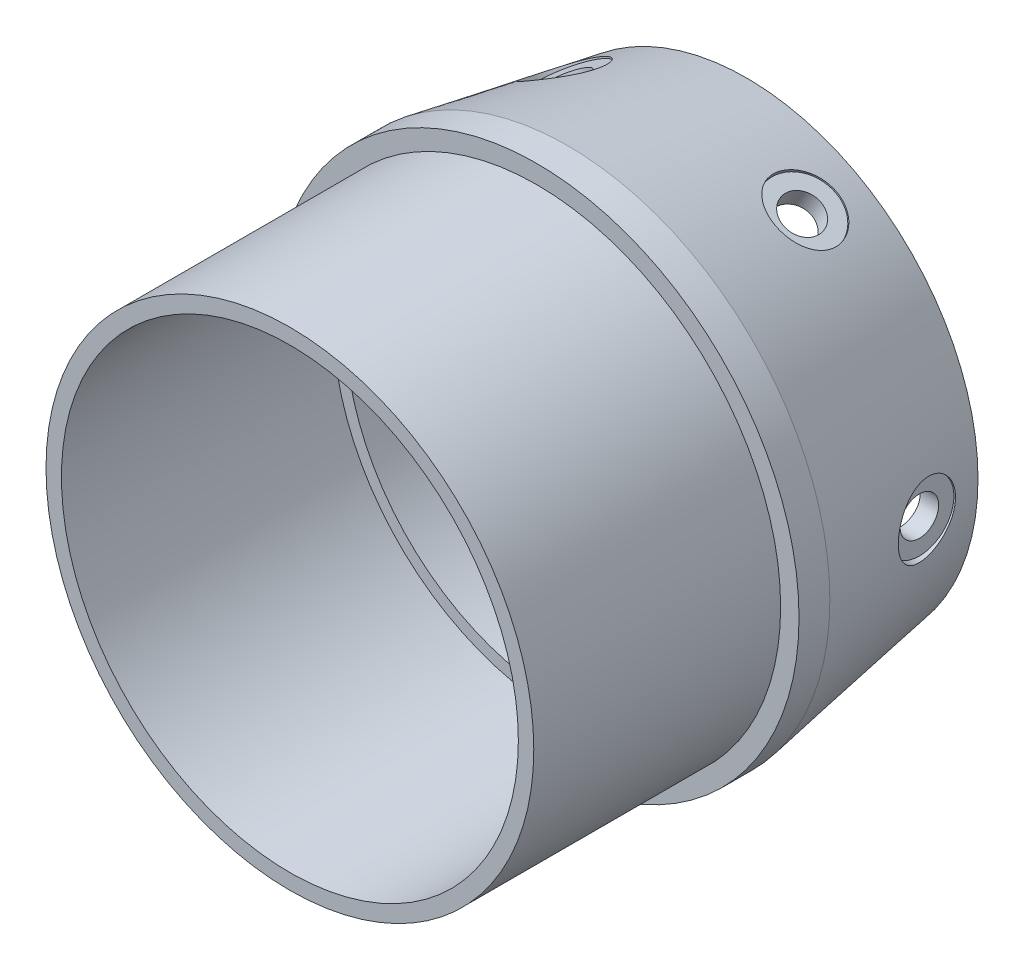
from build123d import *

# Parameters (mm, degrees)
SKETCH2_R          = 1.9812
CUT_EXTRUDE1_DEPTH = 61.53685169
CUT_EXTRUDE2_START = 24.13
SKETCH3_R          = 3.556
CUT_EXTRUDE2_DEPTH = 2.54
CIRPATTERN1_COUNT  = 6


with BuildPart() as part:
    # Sketch1 → Revolve1 (revolve)
    with BuildSketch(Plane(origin=(0, 0, 0), x_dir=(0, 0, -1), z_dir=(1, 0, 0)), mode=Mode.PRIVATE) as revolve1_sk:
        Polygon((0, 23.5077), (27.94, 23.5077), (27.94, 22.225), (46.99, 22.225), (46.99, 23.8125), (28.575, 26.9875), (25.4, 26.9875), (25.4, 25.0952), (0, 25.0952), align=None)
    revolve(revolve1_sk.sketch.rotate(Axis((0, 0, 0), (0, 0, -1)), 90), axis=Axis((0, 0, 0), (0, 0, -1)))

    # Sketch2 → Cut-Extrude1 (cut, through all)
    with BuildSketch(Plane(origin=(0, 0, 0), x_dir=(0, 0, -1), z_dir=(1, 0, 0))):
        with Locations(Location((40.64, 0, 0), (0, 0, 179.999999954))):
            Circle(SKETCH2_R)
    cut_extrude1 = extrude(amount=CUT_EXTRUDE1_DEPTH, mode=Mode.SUBTRACT)

    # Sketch3 → Cut-Extrude2 (cut)
    with BuildSketch(Plane(origin=(0, 0, 0), x_dir=(0, 0, -1), z_dir=(1, 0, 0)).offset(CUT_EXTRUDE2_START)):
        with Locations(Location((40.64, 0, 0), (0, 0, 179.999999954))):
            Circle(SKETCH3_R)
    cut_extrude2 = extrude(amount=CUT_EXTRUDE2_DEPTH, mode=Mode.SUBTRACT)

    # CirPattern1: Cut-Extrude1, Cut-Extrude2 ×6 about axis
    cirpattern1_axis = Axis((0, 0, 0), (0, 0, 1))
    add([cut_extrude1.rotate(cirpattern1_axis, i * 360 / CIRPATTERN1_COUNT) for i in range(1, CIRPATTERN1_COUNT)], mode=Mode.SUBTRACT)
    add([cut_extrude2.rotate(cirpattern1_axis, i * 360 / CIRPATTERN1_COUNT) for i in range(1, CIRPATTERN1_COUNT)], mode=Mode.SUBTRACT)


solid = part.part
